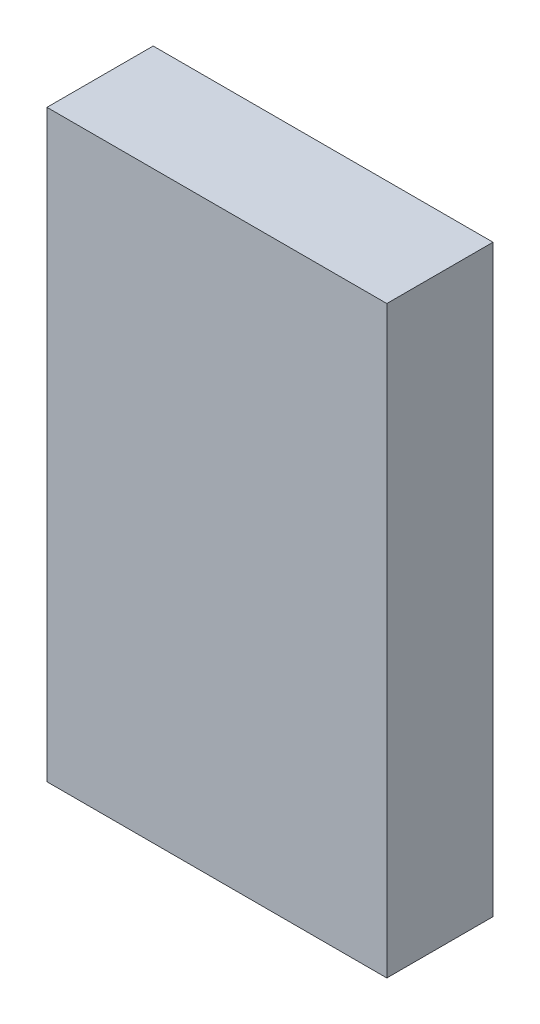
from build123d import *

# Parameters (mm, degrees)
ESQUISSE1_W      = 32
ESQUISSE1_H      = 55
EXTRUSION1_DEPTH = 10


with BuildPart() as part:
    # Esquisse1 → Extrusion1 (new body)
    with BuildSketch(Plane.XY):
        with Locations((16, 27.5)):
            Rectangle(ESQUISSE1_W, ESQUISSE1_H)
    extrude(amount=EXTRUSION1_DEPTH)


solid = part.part
